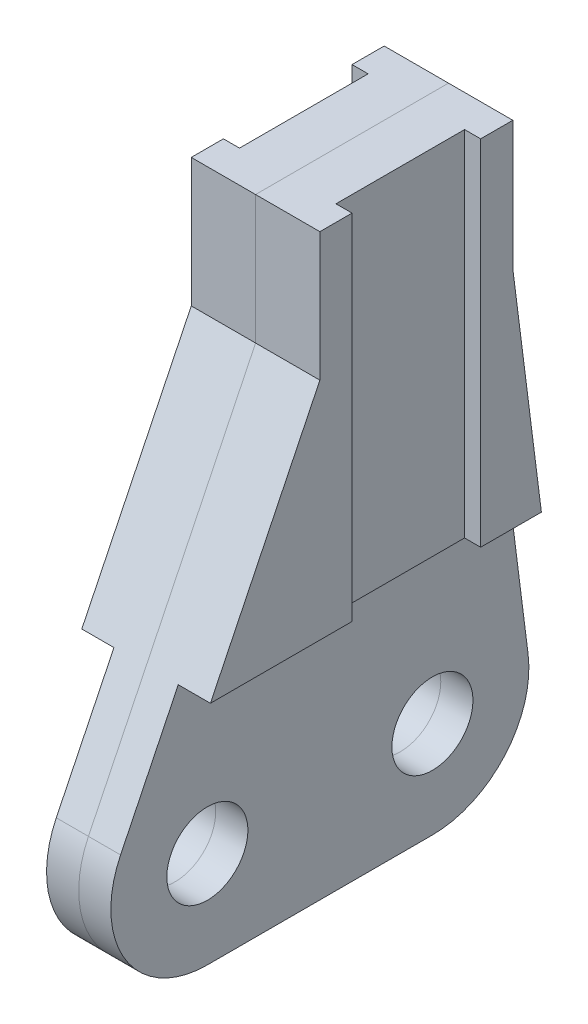
from build123d import *

# Parameters (mm, degrees)
SKETCH1_R           = 8.001
BOSS_EXTRUDE1_DEPTH = 12.7
SKETCH2_W           = 127.926153114
SKETCH2_H           = 63.5
CUT_EXTRUDE1_DEPTH  = 6.35
SKETCH2_3_W         = 25.4
SKETCH2_3_H         = 69.85
CUT_EXTRUDE2_DEPTH  = 3.175
SKETCH3_R           = 6.5484375
CUT_EXTRUDE3_DEPTH  = 75.189091179


with BuildPart() as part:
    # Sketch1 → Boss-Extrude1 (new body)
    with BuildSketch(Plane(origin=(0, 0, 0), x_dir=(0, 0, -1), z_dir=(1, 0, 0))):
        with BuildLine():
            Line((-6.35, 34.925), (-39.356480762, -32.943441508))
            ThreePointArc((-39.356480762, -32.943441508), (-38.374592708, -51.379115764), (-22.225, -60.325))
            Line((-22.225, -60.325), (22.225, -60.325))
            ThreePointArc((22.225, -60.325), (36.518824209, -53.86821601), (41.123185394, -38.874773174))
            Line((41.123185394, -38.874773174), (31.75, 34.925))
            Line((31.75, 34.925), (31.75, 60.325))
            Line((31.75, 60.325), (-6.35, 60.325))
            Line((-6.35, 60.325), (-6.35, 34.925))
        make_face()
        with Locations((-22.225, -41.275)):
            Circle(SKETCH1_R, mode=Mode.SUBTRACT)
        with Locations((22.225, -41.275)):
            Circle(SKETCH1_R, mode=Mode.SUBTRACT)
    extrude(amount=BOSS_EXTRUDE1_DEPTH)

    # Sketch2 → Cut-Extrude1 (cut)
    with BuildSketch(Plane(origin=(12.7, 0, 0), x_dir=(0, 0, -1), z_dir=(1, 0, 0))):
        with Locations((0, -41.275)):
            Rectangle(SKETCH2_W, SKETCH2_H)
    extrude(amount=-CUT_EXTRUDE1_DEPTH, mode=Mode.SUBTRACT)

    # Sketch2<3> → Cut-Extrude2 (cut)
    with BuildSketch(Plane(origin=(12.7, 0, 0), x_dir=(0, 0, -1), z_dir=(1, 0, 0))):
        with Locations((12.7, 25.4)):
            Rectangle(SKETCH2_3_W, SKETCH2_3_H)
    extrude(amount=-CUT_EXTRUDE2_DEPTH, mode=Mode.SUBTRACT)


with BuildPart() as body_2:
    # Mirror1: mirrored copy
    add(part.part.mirror(Plane(origin=(0, 0, 0), x_dir=(0, 0, 1), z_dir=(1, 0, 0))))

    # Sketch3 → Cut-Extrude3 (cut, through all)
    with BuildSketch(Plane(origin=(0, 0, 0), x_dir=(0, 0, -1), z_dir=(1, 0, 0))):
        with Locations((12.7, 9.525)):
            Circle(SKETCH3_R)
        with Locations((12.7, 47.625)):
            Circle(SKETCH3_R)
    extrude(amount=-CUT_EXTRUDE3_DEPTH, mode=Mode.SUBTRACT)


solid = Compound([part.part, body_2.part])
